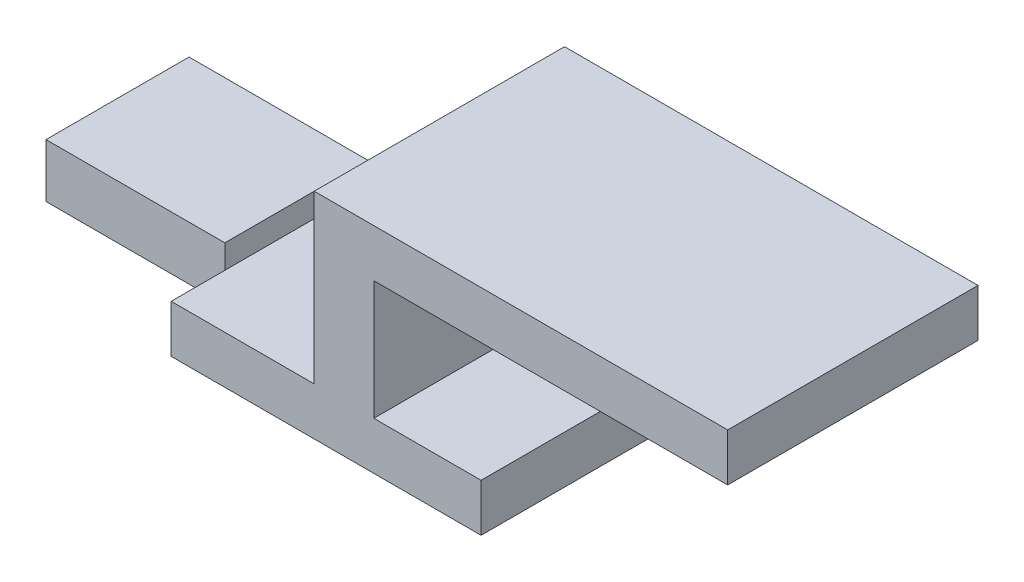
from build123d import *

# Parameters (mm, degrees)
BOSS_EXTRUDE2_DEPTH = 21
SKETCH2_W           = 12
SKETCH2_H           = 4.5
BOSS_EXTRUDE3_DEPTH = 15


with BuildPart() as part:
    # Sketch1 → Boss-Extrude2 (new body)
    with BuildSketch(Plane.XY):
        Polygon((4, 2), (4, 12), (33.684729064, 12), (33.684729064, 16), (-1, 16), (-1, 2), (-13, 2), (-13, -2), (13, -2), (13, 2), align=None)
    extrude(amount=BOSS_EXTRUDE2_DEPTH)

    # Sketch2 → Boss-Extrude3 (add)
    with BuildSketch(Plane.ZY.offset(13)):
        with Locations((10.5, 1.75)):
            Rectangle(SKETCH2_W, SKETCH2_H)
    extrude(amount=BOSS_EXTRUDE3_DEPTH)


solid = part.part
